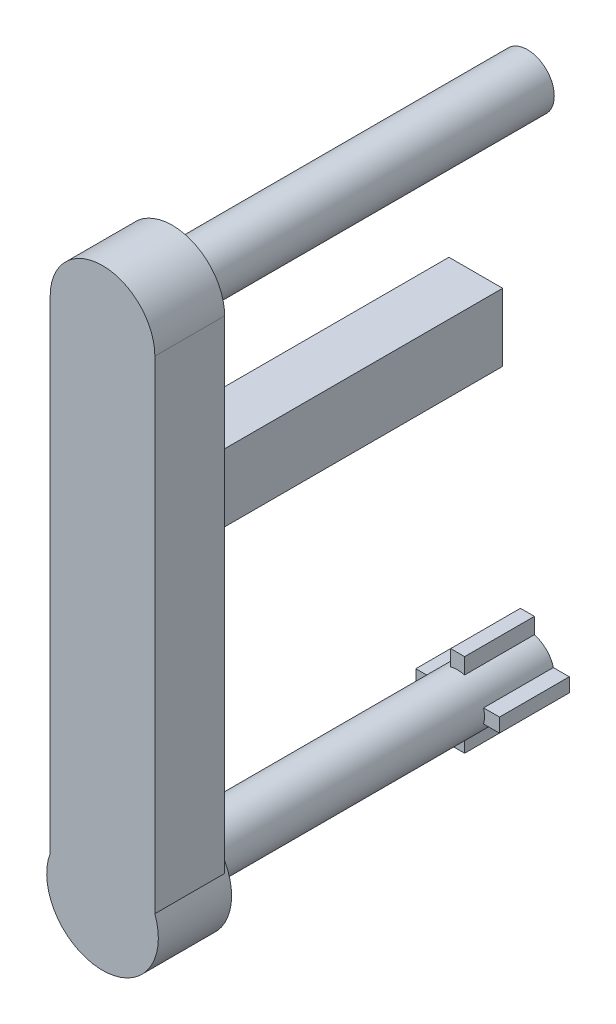
from build123d import *

# Parameters (mm, degrees)
SKETCH1_R           = 8
BOSS_EXTRUDE1_DEPTH = 10.5
SKETCH2_R           = 3.85
BOSS_EXTRUDE2_DEPTH = 60
BOSS_EXTRUDE3_START = -9.6
BOSS_EXTRUDE3_DEPTH = 10
CUT_EXTRUDE1_START  = -9.6
SKETCH6_R           = 3.85
CUT_EXTRUDE1_DEPTH  = 9.6
BOSS_EXTRUDE4_DEPTH = 10
SKETCH8_R           = 4.5
BOSS_EXTRUDE5_DEPTH = 0.5
SKETCH9_R           = 3.85
BOSS_EXTRUDE6_DEPTH = 50.4
SKETCH11_W          = 7.6994
SKETCH11_H          = 9.7
BOSS_EXTRUDE7_DEPTH = 43.5
SKETCH12_R          = 1.75
CUT_EXTRUDE2_DEPTH  = 10


with BuildPart() as part:
    # Sketch1 → Boss-Extrude1 (new body)
    with BuildSketch(Plane.XY):
        Circle(SKETCH1_R)
    extrude(amount=-BOSS_EXTRUDE1_DEPTH)

    # Sketch2 → Boss-Extrude2 (add)
    with BuildSketch(Plane(origin=(0, 0, -10.5), x_dir=(-1, 0, 0), z_dir=(0, 0, -1))):
        Circle(SKETCH2_R)
    extrude(amount=BOSS_EXTRUDE2_DEPTH)

    # Sketch3 → Boss-Extrude3 (add)
    with BuildSketch(Plane(origin=(0, 0, -70.5), x_dir=(-1, 0, 0), z_dir=(0, 0, -1)).offset(BOSS_EXTRUDE3_START)):
        Polygon((-6, 1), (-1, 1), (-1, 6), (1, 6), (1, 1), (6, 1), (6, -1), (1, -1), (1, -6), (-1, -6), (-1, -1), (-6, -1), align=None)
    extrude(amount=-BOSS_EXTRUDE3_DEPTH)

    # Sketch6 → Cut-Extrude1 (cut)
    with BuildSketch(Plane(origin=(0, 0, -70.5), x_dir=(-1, 0, 0), z_dir=(0, 0, -1)).offset(CUT_EXTRUDE1_START)):
        with Locations(Location((0, 0, 0), (0, 0, 195.05465064))):
            Circle(SKETCH6_R)
    extrude(amount=CUT_EXTRUDE1_DEPTH, mode=Mode.SUBTRACT)

    # Sketch7 → Boss-Extrude4 (add)
    with BuildSketch(Plane.XY):
        with BuildLine():
            Line((-7.5, 72), (-7.5, 2.783882181))
            Line((-7.5, 2.783882181), (7.5, 2.783882181))
            Line((7.5, 2.783882181), (7.5, 72))
            ThreePointArc((7.5, 72), (0, 79.5), (-7.5, 72))
        make_face()
    extrude(amount=-BOSS_EXTRUDE4_DEPTH)

    # Sketch8 → Boss-Extrude5 (add)
    with BuildSketch(Plane(origin=(0, 0, -10), x_dir=(-1, 0, 0), z_dir=(0, 0, -1))):
        with Locations(Location((0, 72, 0), (0, 0, 180))):
            Circle(SKETCH8_R)
    extrude(amount=BOSS_EXTRUDE5_DEPTH)

    # Sketch9 → Boss-Extrude6 (add)
    with BuildSketch(Plane(origin=(0, 0, -10.5), x_dir=(-1, 0, 0), z_dir=(0, 0, -1))):
        with Locations(Location((0, 72, 0), (0, 0, 180))):
            Circle(SKETCH9_R)
    extrude(amount=BOSS_EXTRUDE6_DEPTH)

    # Sketch11 → Boss-Extrude7 (add)
    with BuildSketch(Plane(origin=(0, 0, -10), x_dir=(-1, 0, 0), z_dir=(0, 0, -1))):
        with Locations((-0.0003, 47)):
            Rectangle(SKETCH11_W, SKETCH11_H)
    extrude(amount=BOSS_EXTRUDE7_DEPTH)

    # Sketch12 → Cut-Extrude2 (cut)
    with BuildSketch(Plane(origin=(0, 0, -53.5), x_dir=(-1, 0, 0), z_dir=(0, 0, -1))):
        with Locations((-0.0003, 47)):
            Circle(SKETCH12_R)
    extrude(amount=-CUT_EXTRUDE2_DEPTH, mode=Mode.SUBTRACT)


solid = part.part
